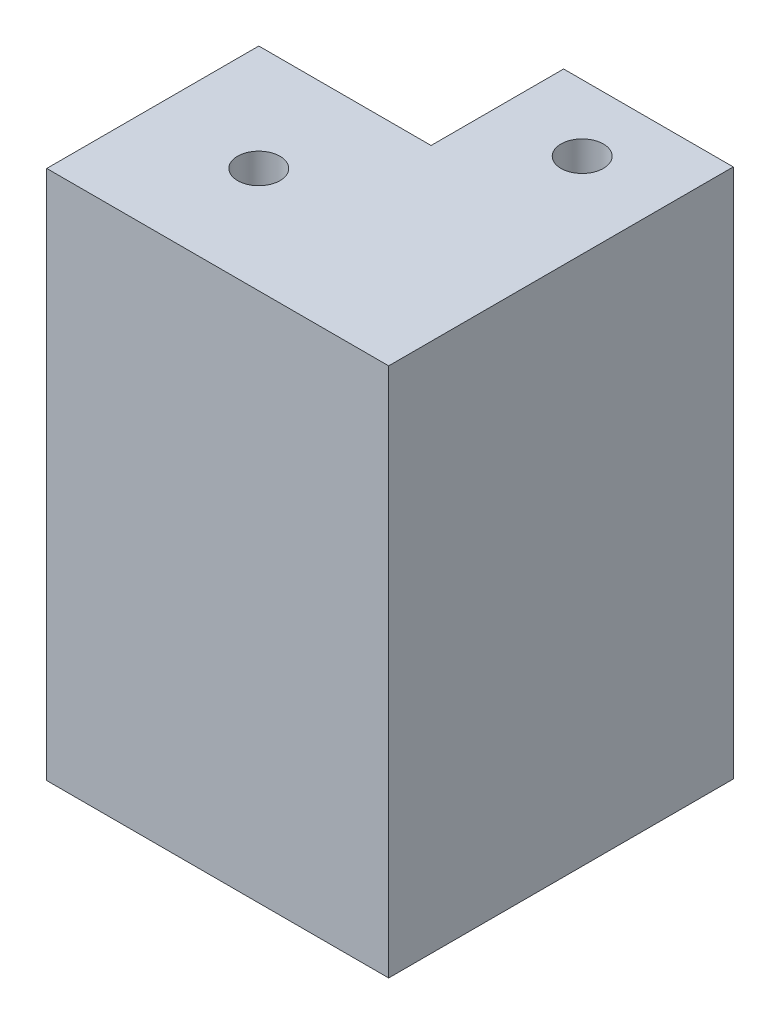
from build123d import *

# Parameters (mm, degrees)
SKETCH1_R                               = 4
BOSS_EXTRUDE1_DEPTH                     = 100
CBORE_FOR_M5_HEX_HEAD_BOLT2_D           = 13.5
CBORE_FOR_M5_HEX_HEAD_BOLT2_DEPTH       = 23.85
CBORE_FOR_M5_HEX_HEAD_BOLT2_CBORE_D     = 32
CBORE_FOR_M5_HEX_HEAD_BOLT2_CBORE_DEPTH = 5
CBORE_FOR_M5_HEX_HEAD_BOLT3_D           = 10.2
CBORE_FOR_M5_HEX_HEAD_BOLT3_DEPTH       = 13.5
CBORE_FOR_M5_HEX_HEAD_BOLT3_CBORE_D     = 22
CBORE_FOR_M5_HEX_HEAD_BOLT3_CBORE_DEPTH = 3.5


with BuildPart() as part:
    # Sketch1 → Boss-Extrude1 (new body)
    with BuildSketch(Plane(origin=(0, 0, 0), x_dir=(1, 0, 0), z_dir=(0, 1, 0))):
        Polygon((-32.5, 0), (0, 0), (0, 25), (32, 25), (32, -40), (-32.5, -40), align=None)
        with Locations(Location((-12.5, -20, 0), (0, 0, 90))):
            Circle(SKETCH1_R, mode=Mode.SUBTRACT)
        with Locations(Location((16, 12.5, 0), (0, 0, 90))):
            Circle(SKETCH1_R, mode=Mode.SUBTRACT)
    extrude(amount=BOSS_EXTRUDE1_DEPTH)

    # CBORE for M5 Hex Head Bolt2
    with Locations(Plane(origin=(0, 0, 0), x_dir=(-1, 0, 0), z_dir=(0, -1, 0))):
        with Locations((12.5, -20)):
            CounterBoreHole(CBORE_FOR_M5_HEX_HEAD_BOLT2_D / 2, CBORE_FOR_M5_HEX_HEAD_BOLT2_CBORE_D / 2, CBORE_FOR_M5_HEX_HEAD_BOLT2_CBORE_DEPTH, depth=CBORE_FOR_M5_HEX_HEAD_BOLT2_DEPTH)

    # CBORE for M5 Hex Head Bolt3
    with Locations(Plane(origin=(0, 0, 0), x_dir=(-1, 0, 0), z_dir=(0, -1, 0))):
        with Locations((-16, 12.5)):
            CounterBoreHole(CBORE_FOR_M5_HEX_HEAD_BOLT3_D / 2, CBORE_FOR_M5_HEX_HEAD_BOLT3_CBORE_D / 2, CBORE_FOR_M5_HEX_HEAD_BOLT3_CBORE_DEPTH, depth=CBORE_FOR_M5_HEX_HEAD_BOLT3_DEPTH)


solid = part.part
